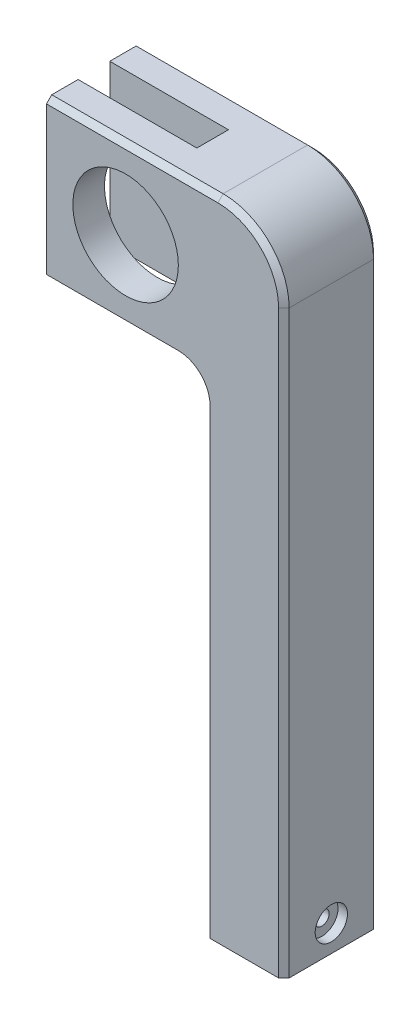
from build123d import *

# Parameters (mm, degrees)
BOSS_EXTRUDE1_DEPTH                     = 18
CUT_EXTRUDE1_REACH                      = 263.628
SKETCH3_W                               = 45
SKETCH3_H                               = 12
FILLET1_R                               = 25
FILLET2_R                               = 10
SKETCH4_R                               = 20
CUT_EXTRUDE2_DEPTH                      = 12
CUT_EXTRUDE3_REACH                      = 265.479
SKETCH5_R                               = 13
CHAMFER1_SIZE                           = 2
CBORE_FOR_M5_HEX_HEAD_BOLT1_D           = 5.5
CBORE_FOR_M5_HEX_HEAD_BOLT1_CBORE_D     = 12.24
CBORE_FOR_M5_HEX_HEAD_BOLT1_CBORE_DEPTH = 3.58
F_3_0MM_DOWEL_HOLE1_D                   = 3
F_3_0MM_DOWEL_HOLE1_DEPTH               = 20
F_3_0MM_DOWEL_HOLE1_TIP                 = 0.901290929


with BuildPart() as part:
    # Sketch1 → Boss-Extrude1 (new, symmetric)
    with BuildSketch(Plane.XY):
        Polygon((0, 0), (-30, 0), (-30, 185), (-90, 185), (-90, 245), (0, 245), align=None)
    extrude(amount=BOSS_EXTRUDE1_DEPTH, both=True)

    # Sketch3 → Cut-Extrude1 (cut, up to next)
    with BuildSketch(Plane(origin=(0, 245, 0), x_dir=(1, 0, 0), z_dir=(0, 1, 0)), mode=Mode.PRIVATE) as cut_extrude1_sk1:
        with Locations((-67.5, 0)):
            Rectangle(SKETCH3_W, SKETCH3_H)
    cut_extrude1_tool1 = extrude(cut_extrude1_sk1.sketch, amount=-CUT_EXTRUDE1_REACH, mode=Mode.PRIVATE) & part.part
    add(cut_extrude1_tool1.solids().sort_by_distance((-67.5, 245, 0))[0], mode=Mode.SUBTRACT)

    # Fillet1
    fillet1_edges = [part.edges().sort_by_distance(p)[0] for p in [
        (0, 245, 0),
    ]]
    fillet(fillet1_edges, radius=FILLET1_R)

    # Fillet2
    fillet2_edges = [part.edges().sort_by_distance(p)[0] for p in [
        (-30, 185, 0),
    ]]
    fillet(fillet2_edges, radius=FILLET2_R)

    # Sketch4 → Cut-Extrude2 (cut)
    with BuildSketch(Plane.XY.offset(18)):
        with Locations((-60, 215)):
            Circle(SKETCH4_R)
    extrude(amount=-CUT_EXTRUDE2_DEPTH, mode=Mode.SUBTRACT)

    # Sketch5 → Cut-Extrude3 (cut, up to next)
    with BuildSketch(Plane(origin=(0, 0, -18), x_dir=(-1, 0, 0), z_dir=(0, 0, -1)), mode=Mode.PRIVATE) as cut_extrude3_sk1:
        with Locations((60, 215)):
            Circle(SKETCH5_R)
    cut_extrude3_tool1 = extrude(cut_extrude3_sk1.sketch, amount=-CUT_EXTRUDE3_REACH, mode=Mode.PRIVATE) & part.part
    add(cut_extrude3_tool1.solids().sort_by_distance((-60, 215, -18))[0], mode=Mode.SUBTRACT)

    # Chamfer1
    chamfer1_edges = [part.edges().sort_by_distance(p)[0] for p in [
        (-65, 185, -18),
        (-57.5, 245, 18),
        (-7.32233047, 237.67766953, 18),
        (-57.5, 245, -18),
        (-7.32233047, 237.67766953, -18),
        (-30, 87.5, 18),
        (-30, 87.5, -18),
        (-32.928932188, 182.071067812, 18),
        (-32.928932188, 182.071067812, -18),
        (0, 110, -18),
        (-65, 185, 18),
        (0, 110, 18),
    ]]
    chamfer(chamfer1_edges, length=CHAMFER1_SIZE)

    # CBORE for M5 Hex Head Bolt1 (through all)
    with Locations(Plane(origin=(0, 0, 0), x_dir=(0, 0, -1), z_dir=(1, 0, 0))):
        with Locations((0, 10)):
            CounterBoreHole(CBORE_FOR_M5_HEX_HEAD_BOLT1_D / 2, CBORE_FOR_M5_HEX_HEAD_BOLT1_CBORE_D / 2, CBORE_FOR_M5_HEX_HEAD_BOLT1_CBORE_DEPTH)

    # Ø3.0mm Dowel Hole1
    with Locations(Plane.ZY.offset(90)):
        with Locations((12, 240), (-12, 190), (-12, 240), (12, 190)):
            Hole(F_3_0MM_DOWEL_HOLE1_D / 2, depth=F_3_0MM_DOWEL_HOLE1_DEPTH)
            with Locations((0, 0, -(F_3_0MM_DOWEL_HOLE1_DEPTH + F_3_0MM_DOWEL_HOLE1_TIP / 2))):  # 118° drill point
                Cone(0, F_3_0MM_DOWEL_HOLE1_D / 2, F_3_0MM_DOWEL_HOLE1_TIP, mode=Mode.SUBTRACT)


solid = part.part
